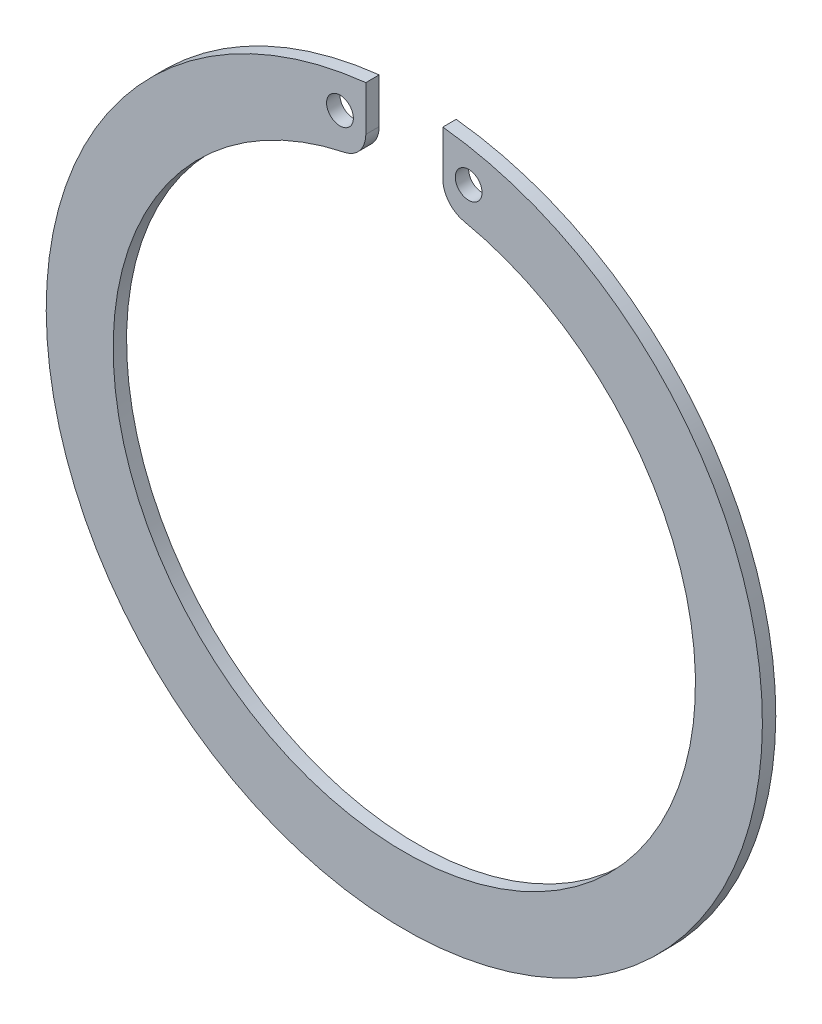
from build123d import *

# Parameters (mm, degrees)
SKETCH_1_R          = 26.75
SKETCH_1_R_2        = 21.75
EXTRUDE_1_DEPTH     = 1
SKETCH_2_W          = 5.751238768
SKETCH_2_H          = 20.704459562
CUT_EXTRUDE_1_DEPTH = 10
FILLET_1_R          = 2
SKETCH_3_R          = 1
CUT_EXTRUDE_2_DEPTH = 10


with BuildPart() as part:
    # 草图1 → 拉伸-薄壁1 (new body)
    with BuildSketch(Plane.XY):
        Circle(SKETCH_1_R)
        Circle(SKETCH_1_R_2, mode=Mode.SUBTRACT)
    extrude(amount=EXTRUDE_1_DEPTH)

    # 草图2 → 切除-拉伸1 (cut)
    with BuildSketch(Plane.XY.offset(1)):
        with Locations((0, 17.972621147)):
            Rectangle(SKETCH_2_W, SKETCH_2_H)
    extrude(amount=-CUT_EXTRUDE_1_DEPTH, mode=Mode.SUBTRACT)

    # 圆角1
    fillet_1_edges = [part.edges().sort_by_distance(p)[0] for p in [
        (2.875619384, 21.559065684, 0.5),
        (-2.875619384, 21.559065684, 0.5),
    ]]
    fillet(fillet_1_edges, radius=FILLET_1_R)

    # 草图3 → 切除-拉伸2 (cut)
    with BuildSketch(Plane.XY.offset(1)):
        with Locations((-4.807050905, 23.823279289)):
            Circle(SKETCH_3_R)
        with Locations((4.807050905, 23.823279289)):
            Circle(SKETCH_3_R)
    extrude(amount=-CUT_EXTRUDE_2_DEPTH, mode=Mode.SUBTRACT)


solid = part.part
